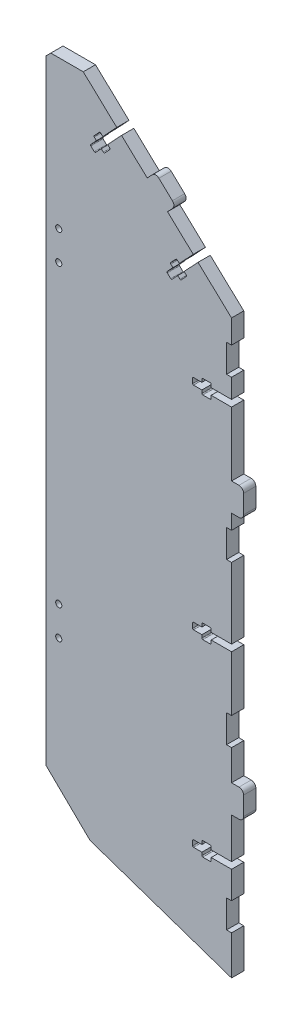
from build123d import *

# Parameters (mm, degrees)
MODEL_R             = 1.6637
BOSS_EXTRUDE1_DEPTH = 6.6


with BuildPart() as part:
    # Model → Boss-Extrude1 (new body)
    with BuildSketch(Plane.XY):
        with BuildLine():
            Line((-2.7, 21.1), (0, 21.1))
            Line((0, 21.1), (0, 0))
            Line((0, 0), (-76.35, 26.1117))
            Line((-76.35, 26.1117), (-100, 49.2))
            Line((-100, 49.2), (-100, 380.9))
            Line((-100, 380.9), (-97.5, 383.4))
            Line((-97.5, 383.4), (-80, 383.4))
            Line((-80, 383.4), (-61.92031318, 366.450293606))
            Line((-61.92031318, 366.450293606), (-69.443665597, 358.42538436))
            Line((-69.443665597, 358.42538436), (-70.599982066, 359.50943105))
            ThreePointArc((-70.599982066, 359.50943105), (-70.958073277, 359.644402505), (-71.306721232, 359.486633012))
            Line((-71.306721232, 359.486633012), (-74.042485748, 356.568484196))
            ThreePointArc((-74.042485748, 356.568484196), (-74.177457203, 356.210392984), (-74.01968771, 355.861745029))
            Line((-74.01968771, 355.861745029), (-72.863371242, 354.77769834))
            Line((-72.863371242, 354.77769834), (-75.941106322, 351.494780921))
            ThreePointArc((-75.941106322, 351.494780921), (-76.076077777, 351.13668971), (-75.918308284, 350.788041755))
            Line((-75.918308284, 350.788041755), (-74.057988413, 349.043991876))
            ThreePointArc((-74.057988413, 349.043991876), (-73.699897202, 348.909020421), (-73.351249247, 349.066789913))
            Line((-73.351249247, 349.066789913), (-70.273514167, 352.349707332))
            Line((-70.273514167, 352.349707332), (-69.117197698, 351.265660643))
            ThreePointArc((-69.117197698, 351.265660643), (-68.759106487, 351.130689188), (-68.410458532, 351.288458681))
            Line((-68.410458532, 351.288458681), (-65.674694016, 354.206607497))
            ThreePointArc((-65.674694016, 354.206607497), (-65.539722561, 354.564698709), (-65.697492054, 354.913346664))
            Line((-65.697492054, 354.913346664), (-66.853808523, 355.997393353))
            Line((-66.853808523, 355.997393353), (-59.330456105, 364.022302598))
            Line((-59.330456105, 364.022302598), (-45.469249226, 351.02742115))
            Line((-45.469249226, 351.02742115), (-42.733484711, 353.945569966))
            ThreePointArc((-42.733484711, 353.945569966), (-40.990244935, 354.73441743), (-39.199788878, 354.059560154))
            Line((-39.199788878, 354.059560154), (-31.904416837, 347.220148866))
            ThreePointArc((-31.904416837, 347.220148866), (-31.115569373, 345.47690909), (-31.790426649, 343.686453033))
            Line((-31.790426649, 343.686453033), (-34.526191164, 340.768304216))
            Line((-34.526191164, 340.768304216), (-20.664984286, 327.773422768))
            Line((-20.664984286, 327.773422768), (-28.188336703, 319.748513522))
            Line((-28.188336703, 319.748513522), (-29.344653172, 320.832560211))
            ThreePointArc((-29.344653172, 320.832560211), (-29.702744383, 320.967531667), (-30.051392338, 320.809762174))
            Line((-30.051392338, 320.809762174), (-32.787156854, 317.891613357))
            ThreePointArc((-32.787156854, 317.891613357), (-32.922128309, 317.533522146), (-32.764358816, 317.184874191))
            Line((-32.764358816, 317.184874191), (-31.608042348, 316.100827502))
            Line((-31.608042348, 316.100827502), (-34.685777428, 312.817910083))
            ThreePointArc((-34.685777428, 312.817910083), (-34.820748883, 312.459818871), (-34.66297939, 312.111170916))
            Line((-34.66297939, 312.111170916), (-32.802659519, 310.367121038))
            ThreePointArc((-32.802659519, 310.367121038), (-32.444568308, 310.232149583), (-32.095920353, 310.389919075))
            Line((-32.095920353, 310.389919075), (-29.018185273, 313.672836494))
            Line((-29.018185273, 313.672836494), (-27.861868804, 312.588789805))
            ThreePointArc((-27.861868804, 312.588789805), (-27.503777593, 312.45381835), (-27.155129638, 312.611587842))
            Line((-27.155129638, 312.611587842), (-24.419365122, 315.529736659))
            ThreePointArc((-24.419365122, 315.529736659), (-24.284393667, 315.88782787), (-24.44216316, 316.236475825))
            Line((-24.44216316, 316.236475825), (-25.598479629, 317.320522515))
            Line((-25.598479629, 317.320522515), (-18.075127211, 325.34543176))
            Line((-18.075127211, 325.34543176), (0, 308.4))
            Line((0, 308.4), (0, 295.7))
            Line((0, 295.7), (-2.7, 295.7))
            Line((-2.7, 295.7), (-2.7, 280.7))
            Line((-2.7, 280.7), (0, 280.7))
            Line((0, 280.7), (0, 270.3))
            Line((0, 270.3), (-11, 270.3))
            Line((-11, 270.3), (-11, 271.885))
            ThreePointArc((-11, 271.885), (-11.146446609, 272.238553391), (-11.5, 272.385))
            Line((-11.5, 272.385), (-15.5, 272.385))
            ThreePointArc((-15.5, 272.385), (-15.853553391, 272.238553391), (-16, 271.885))
            Line((-16, 271.885), (-16, 270.3))
            Line((-16, 270.3), (-20.5, 270.3))
            ThreePointArc((-20.5, 270.3), (-20.853553391, 270.153553391), (-21, 269.8))
            Line((-21, 269.8), (-21, 267.25))
            ThreePointArc((-21, 267.25), (-20.853553391, 266.896446609), (-20.5, 266.75))
            Line((-20.5, 266.75), (-16, 266.75))
            Line((-16, 266.75), (-16, 265.165))
            ThreePointArc((-16, 265.165), (-15.853553391, 264.811446609), (-15.5, 264.665))
            Line((-15.5, 264.665), (-11.5, 264.665))
            ThreePointArc((-11.5, 264.665), (-11.146446609, 264.811446609), (-11, 265.165))
            Line((-11, 265.165), (-11, 266.75))
            Line((-11, 266.75), (0, 266.75))
            Line((0, 266.75), (0, 232.2))
            Line((0, 232.2), (4, 232.2))
            ThreePointArc((4, 232.2), (5.767766953, 231.467766953), (6.5, 229.7))
            Line((6.5, 229.7), (6.5, 219.7))
            ThreePointArc((6.5, 219.7), (5.767766953, 217.932233047), (4, 217.2))
            Line((4, 217.2), (0, 217.2))
            Line((0, 217.2), (0, 209.166666667))
            Line((0, 209.166666667), (-2.7, 209.166666667))
            Line((-2.7, 209.166666667), (-2.7, 194.166666667))
            Line((-2.7, 194.166666667), (0, 194.166666667))
            Line((0, 194.166666667), (0, 155.975))
            Line((0, 155.975), (-11, 155.975))
            Line((-11, 155.975), (-11, 157.56))
            ThreePointArc((-11, 157.56), (-11.146446609, 157.913553391), (-11.5, 158.06))
            Line((-11.5, 158.06), (-15.5, 158.06))
            ThreePointArc((-15.5, 158.06), (-15.853553391, 157.913553391), (-16, 157.56))
            Line((-16, 157.56), (-16, 155.975))
            Line((-16, 155.975), (-20.5, 155.975))
            ThreePointArc((-20.5, 155.975), (-20.853553391, 155.828553391), (-21, 155.475))
            Line((-21, 155.475), (-21, 152.925))
            ThreePointArc((-21, 152.925), (-20.853553391, 152.571446609), (-20.5, 152.425))
            Line((-20.5, 152.425), (-16, 152.425))
            Line((-16, 152.425), (-16, 150.84))
            ThreePointArc((-16, 150.84), (-15.853553391, 150.486446609), (-15.5, 150.34))
            Line((-15.5, 150.34), (-11.5, 150.34))
            ThreePointArc((-11.5, 150.34), (-11.146446609, 150.486446609), (-11, 150.84))
            Line((-11, 150.84), (-11, 152.425))
            Line((-11, 152.425), (0, 152.425))
            Line((0, 152.425), (0, 122.633333333))
            Line((0, 122.633333333), (-2.7, 122.633333333))
            Line((-2.7, 122.633333333), (-2.7, 107.633333333))
            Line((-2.7, 107.633333333), (0, 107.633333333))
            Line((0, 107.633333333), (0, 91.2))
            Line((0, 91.2), (4, 91.2))
            ThreePointArc((4, 91.2), (5.767766953, 90.467766953), (6.5, 88.7))
            Line((6.5, 88.7), (6.5, 78.7))
            ThreePointArc((6.5, 78.7), (5.767766953, 76.932233047), (4, 76.2))
            Line((4, 76.2), (0, 76.2))
            Line((0, 76.2), (0, 54.35))
            Line((0, 54.35), (-11, 54.35))
            Line((-11, 54.35), (-11, 55.935))
            ThreePointArc((-11, 55.935), (-11.146446609, 56.288553391), (-11.5, 56.435))
            Line((-11.5, 56.435), (-15.5, 56.435))
            ThreePointArc((-15.5, 56.435), (-15.853553391, 56.288553391), (-16, 55.935))
            Line((-16, 55.935), (-16, 54.35))
            Line((-16, 54.35), (-20.5, 54.35))
            ThreePointArc((-20.5, 54.35), (-20.853553391, 54.203553391), (-21, 53.85))
            Line((-21, 53.85), (-21, 51.3))
            ThreePointArc((-21, 51.3), (-20.853553391, 50.946446609), (-20.5, 50.8))
            Line((-20.5, 50.8), (-16, 50.8))
            Line((-16, 50.8), (-16, 49.215))
            ThreePointArc((-16, 49.215), (-15.853553391, 48.861446609), (-15.5, 48.715))
            Line((-15.5, 48.715), (-11.5, 48.715))
            ThreePointArc((-11.5, 48.715), (-11.146446609, 48.861446609), (-11, 49.215))
            Line((-11, 49.215), (-11, 50.8))
            Line((-11, 50.8), (0, 50.8))
            Line((0, 50.8), (0, 36.1))
            Line((0, 36.1), (-2.7, 36.1))
            Line((-2.7, 36.1), (-2.7, 21.1))
        make_face()
        with Locations((-93.2095625, 128.122348004)):
            Circle(MODEL_R, mode=Mode.SUBTRACT)
        with Locations((-93.2095625, 112.247348004)):
            Circle(MODEL_R, mode=Mode.SUBTRACT)
        with Locations((-93.2095625, 303.522348003)):
            Circle(MODEL_R, mode=Mode.SUBTRACT)
        with Locations((-93.2095625, 287.647348003)):
            Circle(MODEL_R, mode=Mode.SUBTRACT)
    extrude(amount=BOSS_EXTRUDE1_DEPTH)


solid = part.part
